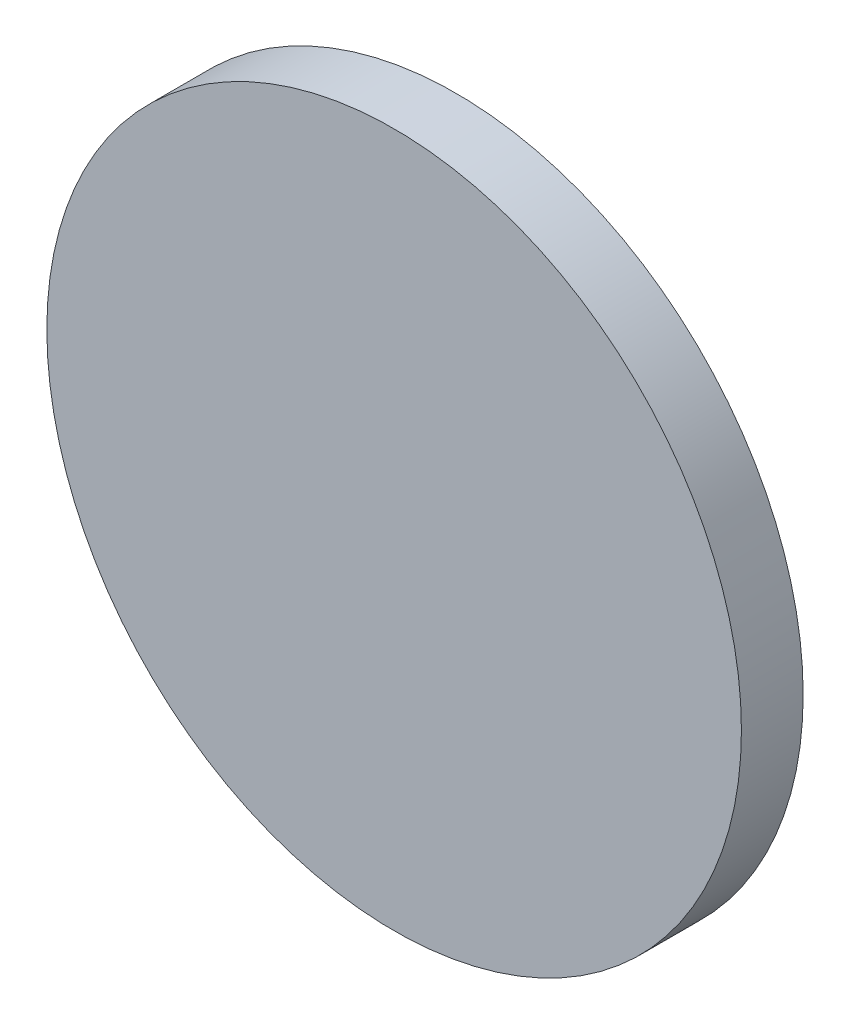
from build123d import *

# Parameters (mm, degrees)
SKETCH1_R           = 11.250729939
BOSS_EXTRUDE1_DEPTH = 2


with BuildPart() as part:
    # Sketch1 → Boss-Extrude1 (new body)
    with BuildSketch(Plane.XY):
        with Locations((0, 39.774230179)):
            Circle(SKETCH1_R)
    extrude(amount=BOSS_EXTRUDE1_DEPTH)


solid = part.part
